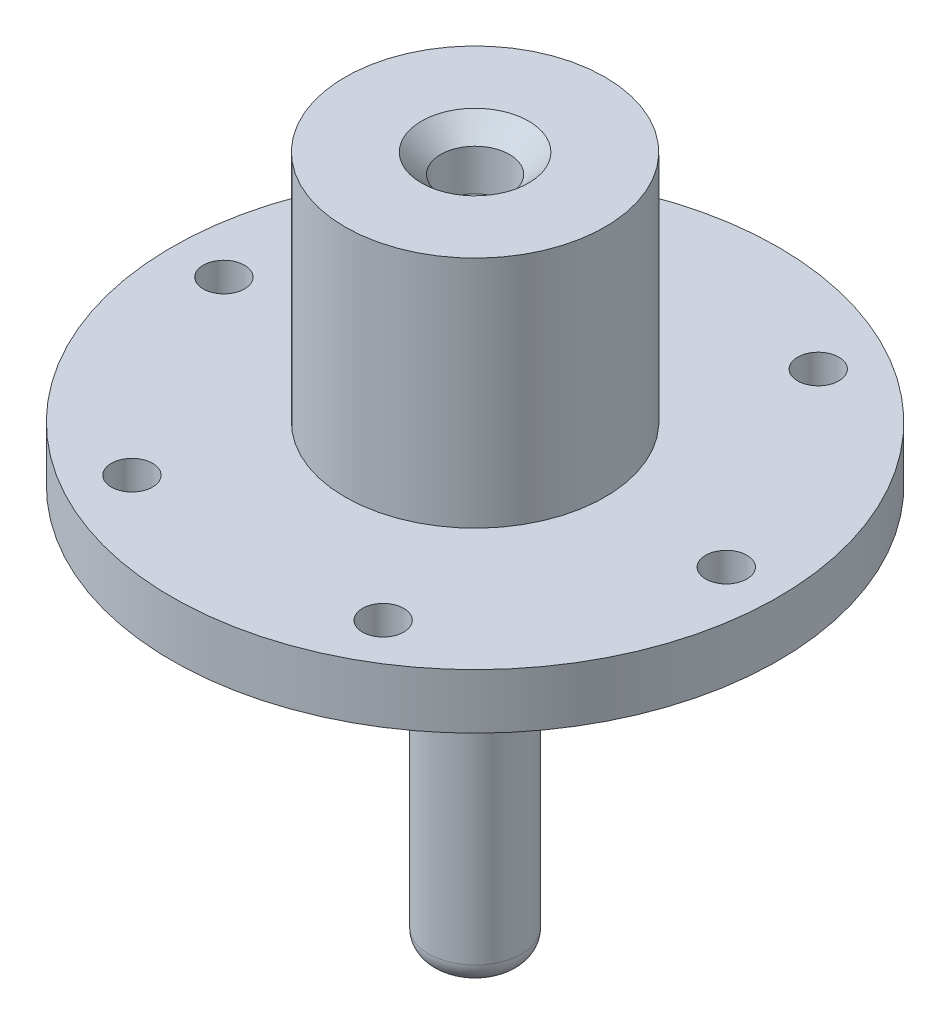
from build123d import *

# Parameters (mm, degrees)
SKETCH5_R                      = 24
SKETCH5_R_2                    = 21
CUT_EXTRUDE1_DEPTH             = 3
F_3_16_0_1875_DIAMETER_HOLE1_D = 4.7625
CIRPATTERN1_COUNT              = 6


with BuildPart() as part:
    # Sketch1 → Revolve1 (revolve)
    with BuildSketch(Plane.XY, mode=Mode.PRIVATE) as revolve1_sk:
        with BuildLine():
            Line((0, 0), (-15, 0))
            Line((-15, 0), (-15, -27))
            Line((-15, -27), (-35, -27))
            Line((-35, -27), (-35, -33.35))
            Line((-35, -33.35), (-12.5, -33.35))
            Line((-12.5, -33.35), (-10, -35.85))
            Line((-10, -35.85), (-10, -45.35))
            Line((-10, -45.35), (-5.3467, -50.0033))
            Line((-5.3467, -50.0033), (-5.3467, -77.5033))
            ThreePointArc((-5.3467, -77.5033), (-4.614466953, -79.271066953), (-2.8467, -80.0033))
            Line((-2.8467, -80.0033), (0, -80.0033))
            Line((0, -80.0033), (0, 0))
        make_face()
    revolve(revolve1_sk.sketch.rotate(Axis((0, -80.0033, 0), (0, 1, 0)), 270), axis=Axis((0, -80.0033, 0), (0, 1, 0)))

    # Sketch4 → 1/16 NPT Tapped Hole1 (revolve, cut)
    with BuildSketch(Plane(origin=(0, 0, 0), x_dir=(0, 0, 1), z_dir=(1, 0, 0))):
        Polygon((0, 0), (0, 78.846685027), (3.0734, 77), (3.0734, 6.89), (3.829121997, 6.89), (3.968877, 2.222373), (6.19125, 0), align=None)
    revolve(axis=Axis((0, 6.35, 0), (0, -1, 0)), mode=Mode.SUBTRACT)

    # Sketch5 → Cut-Extrude1 (cut)
    with BuildSketch(Plane(origin=(0, -33.35, 0), x_dir=(-1, 0, 0), z_dir=(0, -1, 0))):
        with Locations(Location((0, 0, 0), (0, 0, 90))):
            Circle(SKETCH5_R)
        with Locations(Location((0, 0, 0), (0, 0, 90))):
            Circle(SKETCH5_R_2, mode=Mode.SUBTRACT)
    extrude(amount=-CUT_EXTRUDE1_DEPTH, mode=Mode.SUBTRACT)

    # 3/16 (0.1875) Diameter Hole1 (through all)
    with Locations(Plane(origin=(0, -27, 0), x_dir=(1, 0, 0), z_dir=(0, 1, 0))):
        with Locations((29, 0)):
            f_3_16_0_1875_diameter_hole1 = Hole(F_3_16_0_1875_DIAMETER_HOLE1_D / 2)

    # CirPattern1: 3/16 (0.1875) Diameter Hole1 ×6 about axis
    cirpattern1_axis = Axis((0, 0, 0), (0, 1, 0))
    for i in range(1, CIRPATTERN1_COUNT):
        add(f_3_16_0_1875_diameter_hole1.rotate(cirpattern1_axis, i * 360 / CIRPATTERN1_COUNT), mode=Mode.SUBTRACT)


solid = part.part
